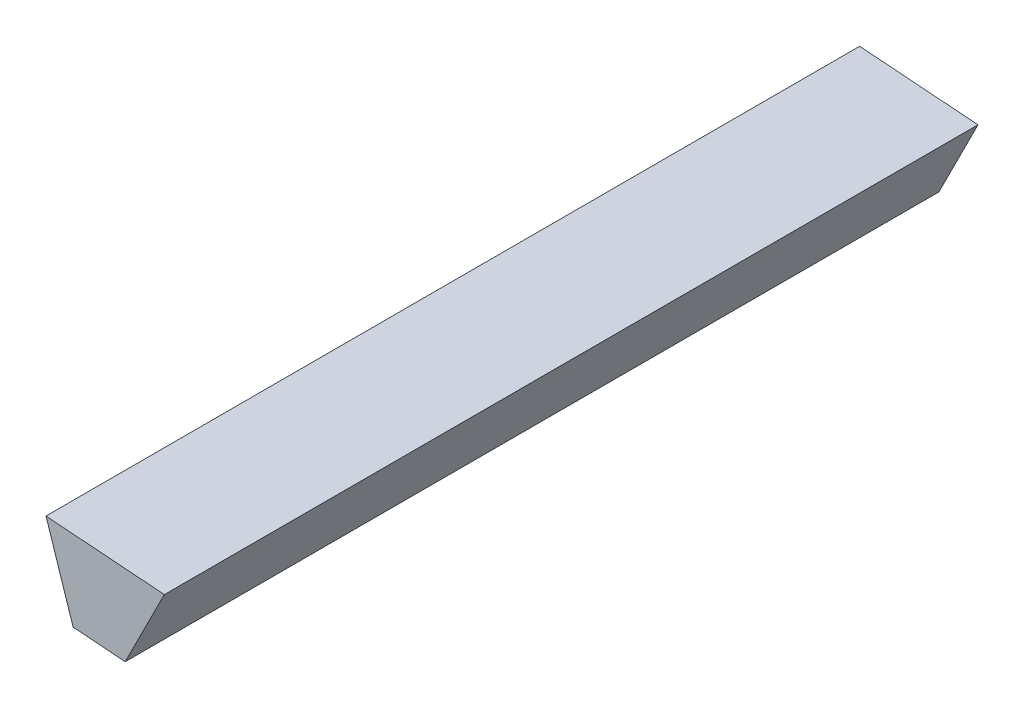
from build123d import *

# Parameters (mm, degrees)
SKETCH_1_R      = 50
EXTRUDE_1_DEPTH = 15
SKETCH_2_R      = 50
SKETCH_2_R_2    = 15
EXTRUDE_2_DEPTH = 25
EXTRUDE_3_DEPTH = 15


with BuildPart() as part:
    # Эскиз1 → Бобышка-Вытянуть1 (new, symmetric)
    with BuildSketch(Plane.XY):
        with BuildLine():
            ThreePointArc((2, 55.964274319), (0, 56), (-2, 55.964274319))
            Line((-2, 55.964274319), (-3, 52.915026221))
            ThreePointArc((-3, 52.915026221), (-3.478337142, 52.885736931), (-3.956389894, 52.852123694))
            ThreePointArc((-3.956389894, 52.852123694), (-3.96069496, 52.851801251), (-3.965, 52.851478456))
            ThreePointArc((-3.965, 52.851478456), (-4.442723091, 52.813466195), (-4.920082944, 52.771135897))
            Line((-4.920082944, 52.771135897), (-6.363380617, 55.637284146))
            ThreePointArc((-6.363380617, 55.637284146), (-8.346366906, 55.374526269), (-10.318703922, 55.041115081))
            Line((-10.318703922, 55.041115081), (-10.853067901, 51.8768823))
            ThreePointArc((-10.853067901, 51.8768823), (-11.32169707, 51.776627695), (-11.789400575, 51.672139825))
            ThreePointArc((-11.789400575, 51.672139825), (-11.7936095, 51.671179346), (-11.797818346, 51.670218524))
            ThreePointArc((-11.797818346, 51.670218524), (-12.264540231, 51.561429896), (-12.730259365, 51.448425598))
            Line((-12.730259365, 51.448425598), (-14.584613826, 54.067448983))
            ThreePointArc((-14.584613826, 54.067448983), (-16.506289767, 53.512077124), (-18.406905049, 52.888428286))
            Line((-18.406905049, 52.888428286), (-18.4636962, 49.679894551))
            ThreePointArc((-18.4636962, 49.679894551), (-18.912148995, 49.510914154), (-19.359055529, 49.337885737))
            ThreePointArc((-19.359055529, 49.337885737), (-19.363074291, 49.336308678), (-19.367092925, 49.334731292))
            ThreePointArc((-19.367092925, 49.334731292), (-19.812387809, 49.157596456), (-20.256062829, 48.976442487))
            Line((-20.256062829, 48.976442487), (-22.480050863, 51.289836354))
            ThreePointArc((-22.480050863, 51.289836354), (-24.297489391, 50.454256603), (-26.083926334, 49.554301398))
            Line((-26.083926334, 49.554301398), (-25.661876036, 46.373140052))
            ThreePointArc((-25.661876036, 46.373140052), (-26.080134762, 46.139208606), (-26.496261172, 45.901504811))
            ThreePointArc((-26.496261172, 45.901504811), (-26.5, 45.899346401), (-26.503738652, 45.897187686))
            ThreePointArc((-26.503738652, 45.897187686), (-26.917659382, 45.655663541), (-27.32937932, 45.410406582))
            Line((-27.32937932, 45.410406582), (-29.87332071, 47.366493535))
            ThreePointArc((-29.87332071, 47.366493535), (-31.545923252, 46.269371362), (-33.178275807, 45.113213302))
            Line((-33.178275807, 45.113213302), (-32.286811966, 42.030486234))
            ThreePointArc((-32.286811966, 42.030486234), (-32.665533415, 41.73682938), (-33.041584125, 41.439760117))
            ThreePointArc((-33.041584125, 41.439760117), (-33.044959499, 41.437068571), (-33.048334653, 41.43437675))
            ThreePointArc((-33.048334653, 41.43437675), (-33.421634925, 41.133858547), (-33.792202639, 40.829977233))
            Line((-33.792202639, 40.829977233), (-36.599269937, 42.38506152))
            ThreePointArc((-36.599269937, 42.38506152), (-38.089673315, 41.050904822), (-39.531477424, 39.664370569))
            Line((-39.531477424, 39.664370569), (-38.19051387, 36.748940806))
            ThreePointArc((-38.19051387, 36.748940806), (-38.52123803, 36.402118354), (-38.848812688, 36.052319659))
            ThreePointArc((-38.848812688, 36.052319659), (-38.851749207, 36.049155102), (-38.854685469, 36.045990306))
            ThreePointArc((-38.854685469, 36.045990306), (-39.179026371, 35.693191124), (-39.50016399, 35.337473661))
            Line((-39.50016399, 35.337473661), (-42.507651952, 36.456817271))
            ThreePointArc((-42.507651952, 36.456817271), (-43.782563018, 34.915428904), (-45.001611159, 33.329491341))
            Line((-45.001611159, 33.329491341), (-43.241102801, 30.646484767))
            ThreePointArc((-43.241102801, 30.646484767), (-43.516441841, 30.254244156), (-43.788222971, 29.859529954))
            ThreePointArc((-43.788222971, 29.859529954), (-43.790655039, 29.855963077), (-43.793086816, 29.852396003))
            ThreePointArc((-43.793086816, 29.852396003), (-44.061223109, 29.455196793), (-44.32575695, 29.055589322))
            Line((-44.32575695, 29.055589322), (-47.466483264, 29.714187967))
            ThreePointArc((-47.466483264, 29.714187967), (-48.497422612, 28), (-49.466483264, 26.250086352))
            Line((-49.466483264, 26.250086352), (-47.32575695, 23.859436899))
            ThreePointArc((-47.32575695, 23.859436899), (-47.539560251, 23.430540138), (-47.74947671, 22.999727692))
            ThreePointArc((-47.74947671, 22.999727692), (-47.751349999, 22.995838173), (-47.753222971, 22.991948502))
            ThreePointArc((-47.753222971, 22.991948502), (-47.959164932, 22.559222039), (-48.161185745, 22.12465113))
            Line((-48.161185745, 22.12465113), (-51.364991776, 22.307792805))
            ThreePointArc((-51.364991776, 22.307792805), (-52.128929924, 20.459097365), (-52.826355874, 18.58429781))
            Line((-52.826355874, 18.58429781), (-50.353231891, 16.539408638))
            ThreePointArc((-50.353231891, 16.539408638), (-50.500723441, 16.083436571), (-50.644086044, 15.626149519))
            ThreePointArc((-50.644086044, 15.626149519), (-50.645358707, 15.622024244), (-50.646631033, 15.617898865))
            ThreePointArc((-50.646631033, 15.617898865), (-50.785778261, 15.159311542), (-50.920773235, 14.699484792))
            Line((-50.920773235, 14.699484792), (-54.11609125, 14.403078414))
            ThreePointArc((-54.11609125, 14.403078414), (-54.595963082, 12.461172302), (-55.006174986, 10.503366765))
            Line((-55.006174986, 10.503366765), (-52.255898839, 8.849917319))
            ThreePointArc((-52.255898839, 8.849917319), (-52.33378392, 8.377055607), (-52.407390182, 7.903508987))
            ThreePointArc((-52.407390182, 7.903508987), (-52.40803379, 7.899240107), (-52.40867705, 7.894971175))
            ThreePointArc((-52.40867705, 7.894971175), (-52.477921224, 7.420767076), (-52.542874795, 6.945956253))
            Line((-52.542874795, 6.945956253), (-55.65832667, 6.176623052))
            ThreePointArc((-55.65832667, 6.176623052), (-55.843412642, 4.184885241), (-55.957247044, 2.187807863))
            Line((-55.957247044, 2.187807863), (-52.991255357, 0.96273347))
            ThreePointArc((-52.991255357, 0.96273347), (-52.997794144, 0.483545065), (-52.999999824, 0.004317125))
            ThreePointArc((-52.999999824, 0.004317125), (-53, 0), (-52.999999824, -0.004317125))
            ThreePointArc((-52.999999824, -0.004317125), (-52.997794144, -0.483545065), (-52.991255357, -0.96273347))
            Line((-52.991255357, -0.96273347), (-55.957247044, -2.187807863))
            ThreePointArc((-55.957247044, -2.187807863), (-55.843412642, -4.184885241), (-55.65832667, -6.176623052))
            Line((-55.65832667, -6.176623052), (-52.542874795, -6.945956253))
            ThreePointArc((-52.542874795, -6.945956253), (-52.477921224, -7.420767076), (-52.40867705, -7.894971175))
            ThreePointArc((-52.40867705, -7.894971175), (-52.40803379, -7.899240107), (-52.407390182, -7.903508987))
            ThreePointArc((-52.407390182, -7.903508987), (-52.33378392, -8.377055607), (-52.255898839, -8.849917319))
            Line((-52.255898839, -8.849917319), (-55.006174986, -10.503366765))
            ThreePointArc((-55.006174986, -10.503366765), (-54.595963082, -12.461172302), (-54.11609125, -14.403078414))
            Line((-54.11609125, -14.403078414), (-50.920773235, -14.699484792))
            ThreePointArc((-50.920773235, -14.699484792), (-50.785778261, -15.159311542), (-50.646631033, -15.617898865))
            ThreePointArc((-50.646631033, -15.617898865), (-50.645358707, -15.622024244), (-50.644086044, -15.626149519))
            ThreePointArc((-50.644086044, -15.626149519), (-50.500723441, -16.083436571), (-50.353231891, -16.539408638))
            Line((-50.353231891, -16.539408638), (-52.826355874, -18.58429781))
            ThreePointArc((-52.826355874, -18.58429781), (-52.128929924, -20.459097365), (-51.364991776, -22.307792805))
            Line((-51.364991776, -22.307792805), (-48.161185745, -22.12465113))
            ThreePointArc((-48.161185745, -22.12465113), (-47.959164932, -22.559222039), (-47.753222971, -22.991948502))
            ThreePointArc((-47.753222971, -22.991948502), (-47.751349999, -22.995838173), (-47.74947671, -22.999727692))
            ThreePointArc((-47.74947671, -22.999727692), (-47.539560251, -23.430540138), (-47.32575695, -23.859436899))
            Line((-47.32575695, -23.859436899), (-49.466483264, -26.250086352))
            ThreePointArc((-49.466483264, -26.250086352), (-48.497422612, -28), (-47.466483264, -29.714187967))
            Line((-47.466483264, -29.714187967), (-44.32575695, -29.055589322))
            ThreePointArc((-44.32575695, -29.055589322), (-44.061223109, -29.455196793), (-43.793086816, -29.852396003))
            ThreePointArc((-43.793086816, -29.852396003), (-43.790655039, -29.855963077), (-43.788222971, -29.859529954))
            ThreePointArc((-43.788222971, -29.859529954), (-43.516441841, -30.254244156), (-43.241102801, -30.646484767))
            Line((-43.241102801, -30.646484767), (-45.001611159, -33.329491341))
            ThreePointArc((-45.001611159, -33.329491341), (-43.782563018, -34.915428904), (-42.507651952, -36.456817271))
            Line((-42.507651952, -36.456817271), (-39.50016399, -35.337473661))
            ThreePointArc((-39.50016399, -35.337473661), (-39.179026371, -35.693191124), (-38.854685469, -36.045990306))
            ThreePointArc((-38.854685469, -36.045990306), (-38.851749207, -36.049155102), (-38.848812688, -36.052319659))
            ThreePointArc((-38.848812688, -36.052319659), (-38.52123803, -36.402118354), (-38.19051387, -36.748940806))
            Line((-38.19051387, -36.748940806), (-39.531477424, -39.664370569))
            ThreePointArc((-39.531477424, -39.664370569), (-38.089673315, -41.050904822), (-36.599269937, -42.38506152))
            Line((-36.599269937, -42.38506152), (-33.792202639, -40.829977233))
            ThreePointArc((-33.792202639, -40.829977233), (-33.421634925, -41.133858547), (-33.048334653, -41.43437675))
            ThreePointArc((-33.048334653, -41.43437675), (-33.044959499, -41.437068571), (-33.041584125, -41.439760117))
            ThreePointArc((-33.041584125, -41.439760117), (-32.665533415, -41.73682938), (-32.286811966, -42.030486234))
            Line((-32.286811966, -42.030486234), (-33.178275807, -45.113213302))
            ThreePointArc((-33.178275807, -45.113213302), (-31.545923252, -46.269371362), (-29.87332071, -47.366493535))
            Line((-29.87332071, -47.366493535), (-27.32937932, -45.410406582))
            ThreePointArc((-27.32937932, -45.410406582), (-26.917659382, -45.655663541), (-26.503738652, -45.897187686))
            ThreePointArc((-26.503738652, -45.897187686), (-26.5, -45.899346401), (-26.496261172, -45.901504811))
            ThreePointArc((-26.496261172, -45.901504811), (-26.080134762, -46.139208606), (-25.661876036, -46.373140052))
            Line((-25.661876036, -46.373140052), (-26.083926334, -49.554301398))
            ThreePointArc((-26.083926334, -49.554301398), (-24.297489391, -50.454256603), (-22.480050863, -51.289836354))
            Line((-22.480050863, -51.289836354), (-20.256062829, -48.976442487))
            ThreePointArc((-20.256062829, -48.976442487), (-19.812387809, -49.157596456), (-19.367092925, -49.334731292))
            ThreePointArc((-19.367092925, -49.334731292), (-19.363074291, -49.336308678), (-19.359055529, -49.337885737))
            ThreePointArc((-19.359055529, -49.337885737), (-18.912148995, -49.510914154), (-18.4636962, -49.679894551))
            Line((-18.4636962, -49.679894551), (-18.406905049, -52.888428286))
            ThreePointArc((-18.406905049, -52.888428286), (-16.506289767, -53.512077124), (-14.584613826, -54.067448983))
            Line((-14.584613826, -54.067448983), (-12.730259365, -51.448425598))
            ThreePointArc((-12.730259365, -51.448425598), (-12.264540231, -51.561429896), (-11.797818346, -51.670218524))
            ThreePointArc((-11.797818346, -51.670218524), (-11.7936095, -51.671179346), (-11.789400575, -51.672139825))
            ThreePointArc((-11.789400575, -51.672139825), (-11.32169707, -51.776627695), (-10.853067901, -51.8768823))
            Line((-10.853067901, -51.8768823), (-10.318703922, -55.041115081))
            ThreePointArc((-10.318703922, -55.041115081), (-8.346366906, -55.374526269), (-6.363380617, -55.637284146))
            Line((-6.363380617, -55.637284146), (-4.920082944, -52.771135897))
            ThreePointArc((-4.920082944, -52.771135897), (-4.442723091, -52.813466195), (-3.965, -52.851478456))
            ThreePointArc((-3.965, -52.851478456), (-3.96069496, -52.851801251), (-3.956389894, -52.852123694))
            ThreePointArc((-3.956389894, -52.852123694), (-3.478337142, -52.885736931), (-3, -52.915026221))
            Line((-3, -52.915026221), (-2, -55.964274319))
            ThreePointArc((-2, -55.964274319), (0, -56), (2, -55.964274319))
            Line((2, -55.964274319), (3, -52.915026221))
            ThreePointArc((3, -52.915026221), (3.478337142, -52.885736931), (3.956389894, -52.852123694))
            ThreePointArc((3.956389894, -52.852123694), (3.96069496, -52.851801251), (3.965, -52.851478456))
            ThreePointArc((3.965, -52.851478456), (4.442723091, -52.813466195), (4.920082944, -52.771135897))
            Line((4.920082944, -52.771135897), (6.363380617, -55.637284146))
            ThreePointArc((6.363380617, -55.637284146), (8.346366906, -55.374526269), (10.318703922, -55.041115081))
            Line((10.318703922, -55.041115081), (10.853067901, -51.8768823))
            ThreePointArc((10.853067901, -51.8768823), (11.32169707, -51.776627695), (11.789400575, -51.672139825))
            ThreePointArc((11.789400575, -51.672139825), (11.7936095, -51.671179346), (11.797818346, -51.670218524))
            ThreePointArc((11.797818346, -51.670218524), (12.264540231, -51.561429896), (12.730259365, -51.448425598))
            Line((12.730259365, -51.448425598), (14.584613826, -54.067448983))
            ThreePointArc((14.584613826, -54.067448983), (16.506289767, -53.512077124), (18.406905049, -52.888428286))
            Line((18.406905049, -52.888428286), (18.4636962, -49.679894551))
            ThreePointArc((18.4636962, -49.679894551), (18.912148995, -49.510914154), (19.359055529, -49.337885737))
            ThreePointArc((19.359055529, -49.337885737), (19.363074291, -49.336308678), (19.367092925, -49.334731292))
            ThreePointArc((19.367092925, -49.334731292), (19.812387809, -49.157596456), (20.256062829, -48.976442487))
            Line((20.256062829, -48.976442487), (22.480050863, -51.289836354))
            ThreePointArc((22.480050863, -51.289836354), (24.297489391, -50.454256603), (26.083926334, -49.554301398))
            Line((26.083926334, -49.554301398), (25.661876036, -46.373140052))
            ThreePointArc((25.661876036, -46.373140052), (26.080134762, -46.139208606), (26.496261172, -45.901504811))
            ThreePointArc((26.496261172, -45.901504811), (26.5, -45.899346401), (26.503738652, -45.897187686))
            ThreePointArc((26.503738652, -45.897187686), (26.917659382, -45.655663541), (27.32937932, -45.410406582))
            Line((27.32937932, -45.410406582), (29.87332071, -47.366493535))
            ThreePointArc((29.87332071, -47.366493535), (31.545923252, -46.269371362), (33.178275807, -45.113213302))
            Line((33.178275807, -45.113213302), (32.286811966, -42.030486234))
            ThreePointArc((32.286811966, -42.030486234), (32.665533415, -41.73682938), (33.041584125, -41.439760117))
            ThreePointArc((33.041584125, -41.439760117), (33.044959499, -41.437068571), (33.048334653, -41.43437675))
            ThreePointArc((33.048334653, -41.43437675), (33.421634925, -41.133858547), (33.792202639, -40.829977233))
            Line((33.792202639, -40.829977233), (36.599269937, -42.38506152))
            ThreePointArc((36.599269937, -42.38506152), (38.089673315, -41.050904822), (39.531477424, -39.664370569))
            Line((39.531477424, -39.664370569), (38.19051387, -36.748940806))
            ThreePointArc((38.19051387, -36.748940806), (38.52123803, -36.402118354), (38.848812688, -36.052319659))
            ThreePointArc((38.848812688, -36.052319659), (38.851749207, -36.049155102), (38.854685469, -36.045990306))
            ThreePointArc((38.854685469, -36.045990306), (39.179026371, -35.693191124), (39.50016399, -35.337473661))
            Line((39.50016399, -35.337473661), (42.507651952, -36.456817271))
            ThreePointArc((42.507651952, -36.456817271), (43.782563018, -34.915428904), (45.001611159, -33.329491341))
            Line((45.001611159, -33.329491341), (43.241102801, -30.646484767))
            ThreePointArc((43.241102801, -30.646484767), (43.516441841, -30.254244156), (43.788222971, -29.859529954))
            ThreePointArc((43.788222971, -29.859529954), (43.790655039, -29.855963077), (43.793086816, -29.852396003))
            ThreePointArc((43.793086816, -29.852396003), (44.061223109, -29.455196793), (44.32575695, -29.055589322))
            Line((44.32575695, -29.055589322), (47.466483264, -29.714187967))
            ThreePointArc((47.466483264, -29.714187967), (48.497422612, -28), (49.466483264, -26.250086352))
            Line((49.466483264, -26.250086352), (47.32575695, -23.859436899))
            ThreePointArc((47.32575695, -23.859436899), (47.539560251, -23.430540138), (47.74947671, -22.999727692))
            ThreePointArc((47.74947671, -22.999727692), (47.751349999, -22.995838173), (47.753222971, -22.991948502))
            ThreePointArc((47.753222971, -22.991948502), (47.959164932, -22.559222039), (48.161185745, -22.12465113))
            Line((48.161185745, -22.12465113), (51.364991776, -22.307792805))
            ThreePointArc((51.364991776, -22.307792805), (52.128929924, -20.459097365), (52.826355874, -18.58429781))
            Line((52.826355874, -18.58429781), (50.353231891, -16.539408638))
            ThreePointArc((50.353231891, -16.539408638), (50.500723441, -16.083436571), (50.644086044, -15.626149519))
            ThreePointArc((50.644086044, -15.626149519), (50.645358707, -15.622024244), (50.646631033, -15.617898865))
            ThreePointArc((50.646631033, -15.617898865), (50.785778261, -15.159311542), (50.920773235, -14.699484792))
            Line((50.920773235, -14.699484792), (54.11609125, -14.403078414))
            ThreePointArc((54.11609125, -14.403078414), (54.595963082, -12.461172302), (55.006174986, -10.503366765))
            Line((55.006174986, -10.503366765), (52.255898839, -8.849917319))
            ThreePointArc((52.255898839, -8.849917319), (52.33378392, -8.377055607), (52.407390182, -7.903508987))
            ThreePointArc((52.407390182, -7.903508987), (52.40803379, -7.899240107), (52.40867705, -7.894971175))
            ThreePointArc((52.40867705, -7.894971175), (52.477921224, -7.420767076), (52.542874795, -6.945956253))
            Line((52.542874795, -6.945956253), (55.65832667, -6.176623052))
            ThreePointArc((55.65832667, -6.176623052), (55.843412642, -4.184885241), (55.957247044, -2.187807863))
            Line((55.957247044, -2.187807863), (52.991255357, -0.96273347))
            ThreePointArc((52.991255357, -0.96273347), (52.997794144, -0.483545065), (52.999999824, -0.004317125))
            ThreePointArc((52.999999824, -0.004317125), (53, 0), (52.999999824, 0.004317125))
            ThreePointArc((52.999999824, 0.004317125), (52.997794144, 0.483545065), (52.991255357, 0.96273347))
            Line((52.991255357, 0.96273347), (55.957247044, 2.187807863))
            ThreePointArc((55.957247044, 2.187807863), (55.843412642, 4.184885241), (55.65832667, 6.176623052))
            Line((55.65832667, 6.176623052), (52.542874795, 6.945956253))
            ThreePointArc((52.542874795, 6.945956253), (52.477921224, 7.420767076), (52.40867705, 7.894971175))
            ThreePointArc((52.40867705, 7.894971175), (52.40803379, 7.899240107), (52.407390182, 7.903508987))
            ThreePointArc((52.407390182, 7.903508987), (52.33378392, 8.377055607), (52.255898839, 8.849917319))
            Line((52.255898839, 8.849917319), (55.006174986, 10.503366765))
            ThreePointArc((55.006174986, 10.503366765), (54.595963082, 12.461172302), (54.11609125, 14.403078414))
            Line((54.11609125, 14.403078414), (50.920773235, 14.699484792))
            ThreePointArc((50.920773235, 14.699484792), (50.785778261, 15.159311542), (50.646631033, 15.617898865))
            ThreePointArc((50.646631033, 15.617898865), (50.645358707, 15.622024244), (50.644086044, 15.626149519))
            ThreePointArc((50.644086044, 15.626149519), (50.500723441, 16.083436571), (50.353231891, 16.539408638))
            Line((50.353231891, 16.539408638), (52.826355874, 18.58429781))
            ThreePointArc((52.826355874, 18.58429781), (52.128929924, 20.459097365), (51.364991776, 22.307792805))
            Line((51.364991776, 22.307792805), (48.161185745, 22.12465113))
            ThreePointArc((48.161185745, 22.12465113), (47.959164932, 22.559222039), (47.753222971, 22.991948502))
            ThreePointArc((47.753222971, 22.991948502), (47.751349999, 22.995838173), (47.74947671, 22.999727692))
            ThreePointArc((47.74947671, 22.999727692), (47.539560251, 23.430540138), (47.32575695, 23.859436899))
            Line((47.32575695, 23.859436899), (49.466483264, 26.250086352))
            ThreePointArc((49.466483264, 26.250086352), (48.497422612, 28), (47.466483264, 29.714187967))
            Line((47.466483264, 29.714187967), (44.32575695, 29.055589322))
            ThreePointArc((44.32575695, 29.055589322), (44.061223109, 29.455196793), (43.793086816, 29.852396003))
            ThreePointArc((43.793086816, 29.852396003), (43.790655039, 29.855963077), (43.788222971, 29.859529954))
            ThreePointArc((43.788222971, 29.859529954), (43.516441841, 30.254244156), (43.241102801, 30.646484767))
            Line((43.241102801, 30.646484767), (45.001611159, 33.329491341))
            ThreePointArc((45.001611159, 33.329491341), (43.782563018, 34.915428904), (42.507651952, 36.456817271))
            Line((42.507651952, 36.456817271), (39.50016399, 35.337473661))
            ThreePointArc((39.50016399, 35.337473661), (39.179026371, 35.693191124), (38.854685469, 36.045990306))
            ThreePointArc((38.854685469, 36.045990306), (38.851749207, 36.049155102), (38.848812688, 36.052319659))
            ThreePointArc((38.848812688, 36.052319659), (38.52123803, 36.402118354), (38.19051387, 36.748940806))
            Line((38.19051387, 36.748940806), (39.531477424, 39.664370569))
            ThreePointArc((39.531477424, 39.664370569), (38.089673315, 41.050904822), (36.599269937, 42.38506152))
            Line((36.599269937, 42.38506152), (33.792202639, 40.829977233))
            ThreePointArc((33.792202639, 40.829977233), (33.421634925, 41.133858547), (33.048334653, 41.43437675))
            ThreePointArc((33.048334653, 41.43437675), (33.044959499, 41.437068571), (33.041584125, 41.439760117))
            ThreePointArc((33.041584125, 41.439760117), (32.665533415, 41.73682938), (32.286811966, 42.030486234))
            Line((32.286811966, 42.030486234), (33.178275807, 45.113213302))
            ThreePointArc((33.178275807, 45.113213302), (31.545923252, 46.269371362), (29.87332071, 47.366493535))
            Line((29.87332071, 47.366493535), (27.32937932, 45.410406582))
            ThreePointArc((27.32937932, 45.410406582), (26.917659382, 45.655663541), (26.503738652, 45.897187686))
            ThreePointArc((26.503738652, 45.897187686), (26.5, 45.899346401), (26.496261172, 45.901504811))
            ThreePointArc((26.496261172, 45.901504811), (26.080134762, 46.139208606), (25.661876036, 46.373140052))
            Line((25.661876036, 46.373140052), (26.083926334, 49.554301398))
            ThreePointArc((26.083926334, 49.554301398), (24.297489391, 50.454256603), (22.480050863, 51.289836354))
            Line((22.480050863, 51.289836354), (20.256062829, 48.976442487))
            ThreePointArc((20.256062829, 48.976442487), (19.812387809, 49.157596456), (19.367092925, 49.334731292))
            ThreePointArc((19.367092925, 49.334731292), (19.363074291, 49.336308678), (19.359055529, 49.337885737))
            ThreePointArc((19.359055529, 49.337885737), (18.912148995, 49.510914154), (18.4636962, 49.679894551))
            Line((18.4636962, 49.679894551), (18.406905049, 52.888428286))
            ThreePointArc((18.406905049, 52.888428286), (16.506289767, 53.512077124), (14.584613826, 54.067448983))
            Line((14.584613826, 54.067448983), (12.730259365, 51.448425598))
            ThreePointArc((12.730259365, 51.448425598), (12.264540231, 51.561429896), (11.797818346, 51.670218524))
            ThreePointArc((11.797818346, 51.670218524), (11.7936095, 51.671179346), (11.789400575, 51.672139825))
            ThreePointArc((11.789400575, 51.672139825), (11.32169707, 51.776627695), (10.853067901, 51.8768823))
            Line((10.853067901, 51.8768823), (10.318703922, 55.041115081))
            ThreePointArc((10.318703922, 55.041115081), (8.346366906, 55.374526269), (6.363380617, 55.637284146))
            Line((6.363380617, 55.637284146), (4.920082944, 52.771135897))
            ThreePointArc((4.920082944, 52.771135897), (4.442723091, 52.813466195), (3.965, 52.851478456))
            ThreePointArc((3.965, 52.851478456), (3.96069496, 52.851801251), (3.956389894, 52.852123694))
            ThreePointArc((3.956389894, 52.852123694), (3.478337142, 52.885736931), (3, 52.915026221))
            Line((3, 52.915026221), (2, 55.964274319))
        make_face()
        Circle(SKETCH_1_R, mode=Mode.SUBTRACT)
    extrude(amount=EXTRUDE_1_DEPTH, both=True)

    # Эскиз2 → Бобышка-Вытянуть2 (add)
    with BuildSketch(Plane(origin=(0, 0, -15), x_dir=(-1, 0, 0), z_dir=(0, 0, -1))):
        Circle(SKETCH_2_R)
        Circle(SKETCH_2_R_2, mode=Mode.SUBTRACT)
        with BuildLine():
            Line((3.453748068, 43), (-3.453748068, 43))
            ThreePointArc((-3.453748068, 43), (-7.427281454, 41.034968275), (-8.277567174, 36.684412971))
            Line((-8.277567174, 36.684412971), (-4.803871921, 23.947530377))
            ThreePointArc((-4.803871921, 23.947530377), (-3.372791256, 21.821173291), (-0.944816636, 21))
            Line((-0.944816636, 21), (0.944816636, 21))
            ThreePointArc((0.944816636, 21), (3.372791256, 21.821173291), (4.803871921, 23.947530377))
            Line((4.803871921, 23.947530377), (8.277567174, 36.684412971))
            ThreePointArc((8.277567174, 36.684412971), (7.427281454, 41.034968275), (3.453748068, 43))
        make_face(mode=Mode.SUBTRACT)
        with BuildLine():
            Line((41.962697048, 10.003021153), (39.828163353, 16.572440364))
            ThreePointArc((39.828163353, 16.572440364), (36.731417782, 19.744266986), (32.331041074, 19.208541237))
            Line((32.331041074, 19.208541237), (21.290976752, 11.968947554))
            ThreePointArc((21.290976752, 11.968947554), (19.710919235, 9.950828486), (19.680222445, 7.3879309))
            Line((19.680222445, 7.3879309), (20.264151239, 5.590782863))
            ThreePointArc((20.264151239, 5.590782863), (21.795418868, 3.535398282), (24.259932876, 2.831440166))
            Line((24.259932876, 2.831440166), (37.446858931, 3.463672837))
            ThreePointArc((37.446858931, 3.463672837), (41.321730165, 5.616738135), (41.962697048, 10.003021153))
        make_face(mode=Mode.SUBTRACT)
        with BuildLine():
            Line((22.480624967, -36.817792937), (28.06890673, -32.757668579))
            ThreePointArc((28.06890673, -32.757668579), (30.128546098, -28.832340194), (28.259249449, -24.812881613))
            Line((28.259249449, -24.812881613), (17.962419207, -16.550313979))
            ThreePointArc((17.962419207, -16.550313979), (15.554809292, -15.67122307), (13.107863013, -16.434007597))
            Line((13.107863013, -16.434007597), (11.579117583, -17.544706167))
            ThreePointArc((11.579117583, -17.544706167), (10.097518404, -19.636176989), (10.189591161, -22.197604117))
            Line((10.189591161, -22.197604117), (14.865864418, -34.543745432))
            ThreePointArc((14.865864418, -34.543745432), (18.110952262, -37.563633201), (22.480624967, -36.817792937))
        make_face(mode=Mode.SUBTRACT)
        with BuildLine():
            Line((-28.06890673, -32.757668579), (-22.480624967, -36.817792937))
            ThreePointArc((-22.480624967, -36.817792937), (-18.110952262, -37.563633201), (-14.865864418, -34.543745432))
            Line((-14.865864418, -34.543745432), (-10.189591161, -22.197604117))
            ThreePointArc((-10.189591161, -22.197604117), (-10.097518404, -19.636176989), (-11.579117583, -17.544706167))
            Line((-11.579117583, -17.544706167), (-13.107863013, -16.434007597))
            ThreePointArc((-13.107863013, -16.434007597), (-15.554809292, -15.67122307), (-17.962419207, -16.550313979))
            Line((-17.962419207, -16.550313979), (-28.259249449, -24.812881613))
            ThreePointArc((-28.259249449, -24.812881613), (-30.128546098, -28.832340194), (-28.06890673, -32.757668579))
        make_face(mode=Mode.SUBTRACT)
        with BuildLine():
            Line((-39.828163353, 16.572440364), (-41.962697048, 10.003021153))
            ThreePointArc((-41.962697048, 10.003021153), (-41.321730165, 5.616738135), (-37.446858931, 3.463672837))
            Line((-37.446858931, 3.463672837), (-24.259932876, 2.831440166))
            ThreePointArc((-24.259932876, 2.831440166), (-21.795418868, 3.535398282), (-20.264151239, 5.590782863))
            Line((-20.264151239, 5.590782863), (-19.680222445, 7.3879309))
            ThreePointArc((-19.680222445, 7.3879309), (-19.710919235, 9.950828486), (-21.290976752, 11.968947554))
            Line((-21.290976752, 11.968947554), (-32.331041074, 19.208541237))
            ThreePointArc((-32.331041074, 19.208541237), (-36.731417782, 19.744266986), (-39.828163353, 16.572440364))
        make_face(mode=Mode.SUBTRACT)
    extrude(amount=-EXTRUDE_2_DEPTH)


with BuildPart() as body_2:
    # Эскиз3 → Бобышка-Вытянуть3 (new, symmetric)
    with BuildSketch(Plane.XY):
        Polygon((2, 55.964274319), (6.363380617, 55.637284146), (4.920082944, 52.771135897), (3, 52.915026221), align=None)
    extrude(amount=EXTRUDE_3_DEPTH, both=True)


solid = body_2.part
